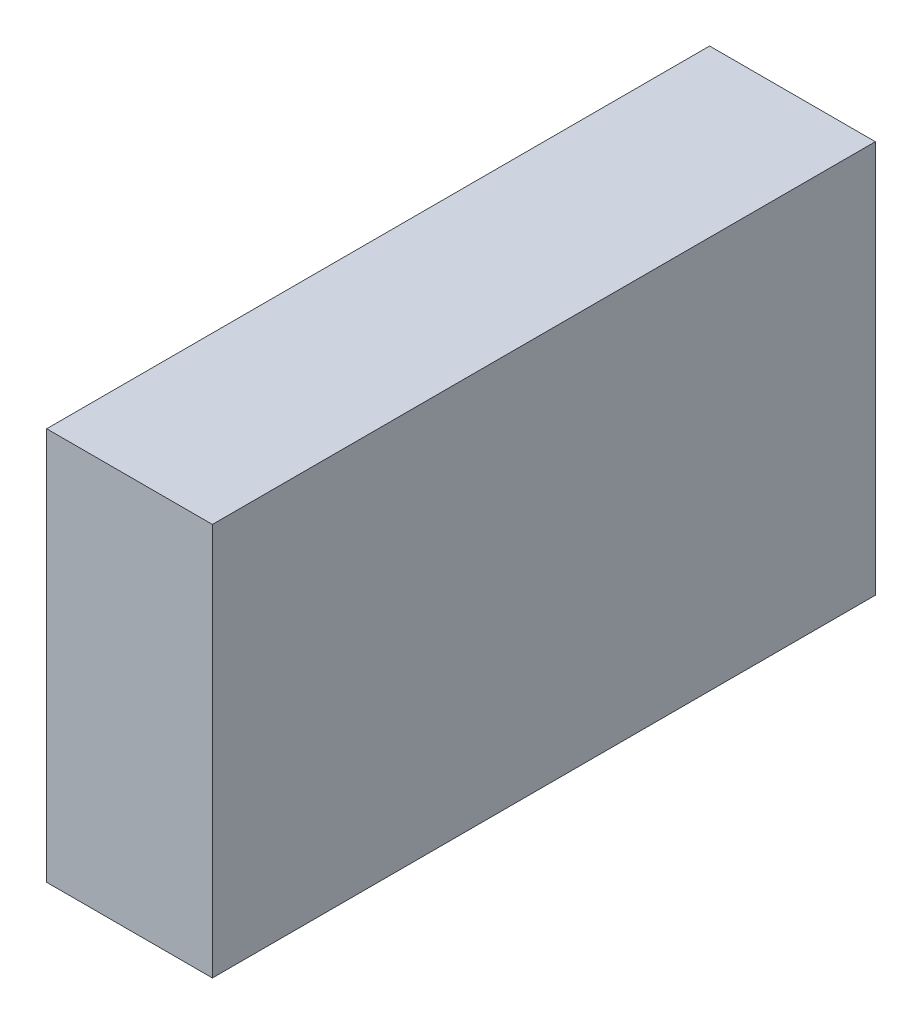
from build123d import *

# Parameters (mm, degrees)
SKETCH1_W           = 40
SKETCH1_H           = 23.7
BOSS_EXTRUDE1_DEPTH = 10


with BuildPart() as part:
    # Sketch1 → Boss-Extrude1 (new body)
    with BuildSketch(Plane(origin=(0, 0, 0), x_dir=(0, 0, -1), z_dir=(1, 0, 0))):
        with Locations((20, 11.85)):
            Rectangle(SKETCH1_W, SKETCH1_H)
    extrude(amount=BOSS_EXTRUDE1_DEPTH)


solid = part.part
